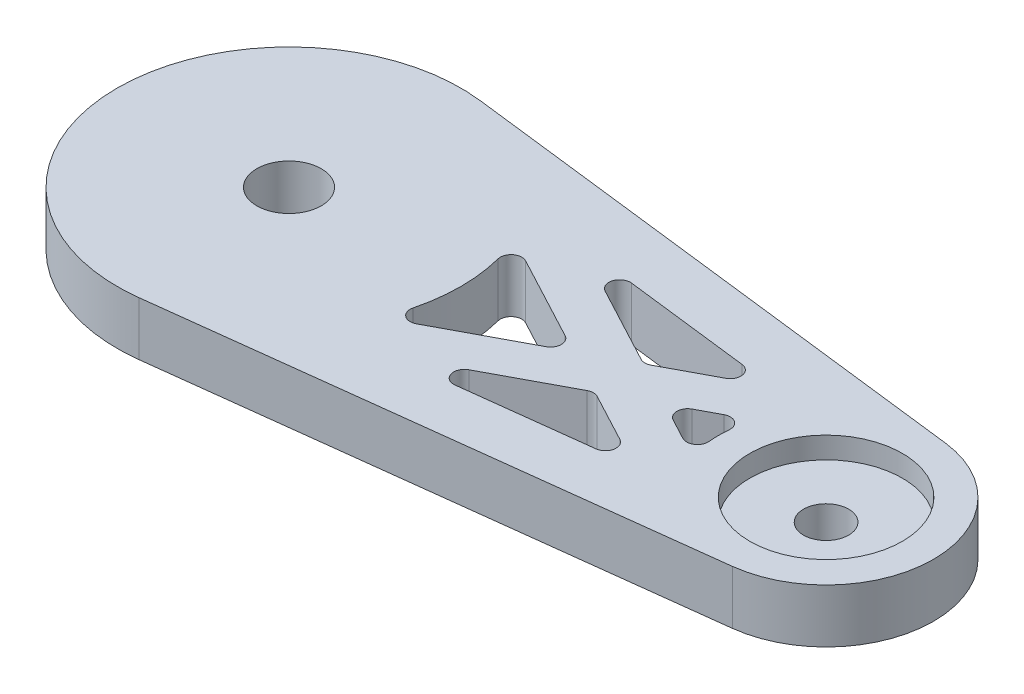
from build123d import *

# Parameters (mm, degrees)
SKETCH_1_R      = 3
SKETCH_1_R_2    = 7.1
EXTRUDE_1_DEPTH = 5
SKETCH_1_3_R    = 7.1
SKETCH_1_3_R_2  = 2.1
EXTRUDE_2_DEPTH = 3
FILLET_1_R      = 1
FILLET_2_R      = 1
FILLET_3_R      = 1
FILLET_4_R      = 1


with BuildPart() as part:
    # 草图1 → 凸台-拉伸1 (new body)
    with BuildSketch(Plane(origin=(0, 0, 0), x_dir=(1, 0, 0), z_dir=(0, 1, 0))):
        with BuildLine():
            ThreePointArc((1.92, 15.884382267), (-16, 0), (1.92, -15.884382267))
            Line((1.92, -15.884382267), (51.2, -9.927738917))
            ThreePointArc((51.2, -9.927738917), (60, 0), (51.2, 9.927738917))
            Line((51.2, 9.927738917), (1.92, 15.884382267))
        make_face()
        Circle(SKETCH_1_R, mode=Mode.SUBTRACT)
        Polygon((38.535462938, -6.422151611), (18.356508588, -8.861251331), (30.734984007, -2.266153232), align=None, mode=Mode.SUBTRACT)
        with BuildLine():
            Line((40.429404433, -2.898913674), (34.988373668, 0))
            Line((34.988373668, 0), (40.429404433, 2.898913674))
            ThreePointArc((40.429404433, 2.898913674), (40, 0), (40.429404433, -2.898913674))
        make_face(mode=Mode.SUBTRACT)
        with Locations((50, 0)):
            Circle(SKETCH_1_R_2, mode=Mode.SUBTRACT)
        with BuildLine():
            ThreePointArc((14.72234722, -6.265180949), (16, 0), (14.72234722, 6.265180949))
            Line((14.72234722, 6.265180949), (26.481594346, 0))
            Line((26.481594346, 0), (14.72234722, -6.265180949))
        make_face(mode=Mode.SUBTRACT)
        Polygon((30.734984007, 2.266153232), (18.356508588, 8.861251331), (38.535462938, 6.422151611), align=None, mode=Mode.SUBTRACT)
    extrude(amount=EXTRUDE_1_DEPTH)

    # 草图1<3> → 凸台-拉伸2 (add)
    with BuildSketch(Plane(origin=(0, 0, 0), x_dir=(1, 0, 0), z_dir=(0, 1, 0))):
        with Locations((50, 0)):
            Circle(SKETCH_1_3_R)
        with Locations((50, 0)):
            Circle(SKETCH_1_3_R_2, mode=Mode.SUBTRACT)
    extrude(amount=EXTRUDE_2_DEPTH)

    # 圆角1
    fillet_1_edges = [part.edges().sort_by_distance(p)[0] for p in [
        (34.988373668, 2.5, 0),
        (40.429404433, 2.5, -2.898913674),
        (40.429404433, 2.5, 2.898913674),
    ]]
    fillet(fillet_1_edges, radius=FILLET_1_R)

    # 圆角2
    fillet_2_edges = [part.edges().sort_by_distance(p)[0] for p in [
        (30.734984007, 2.5, 2.266153232),
        (18.356508588, 2.5, 8.861251331),
        (38.535462938, 2.5, 6.422151611),
    ]]
    fillet(fillet_2_edges, radius=FILLET_2_R)

    # 圆角3
    fillet_3_edges = [part.edges().sort_by_distance(p)[0] for p in [
        (18.356508588, 2.5, -8.861251331),
        (30.734984007, 2.5, -2.266153232),
        (38.535462938, 2.5, -6.422151611),
    ]]
    fillet(fillet_3_edges, radius=FILLET_3_R)

    # 圆角4
    fillet_4_edges = [part.edges().sort_by_distance(p)[0] for p in [
        (14.72234722, 2.5, -6.265180949),
        (26.481594346, 2.5, 0),
        (14.72234722, 2.5, 6.265180949),
    ]]
    fillet(fillet_4_edges, radius=FILLET_4_R)


solid = part.part
